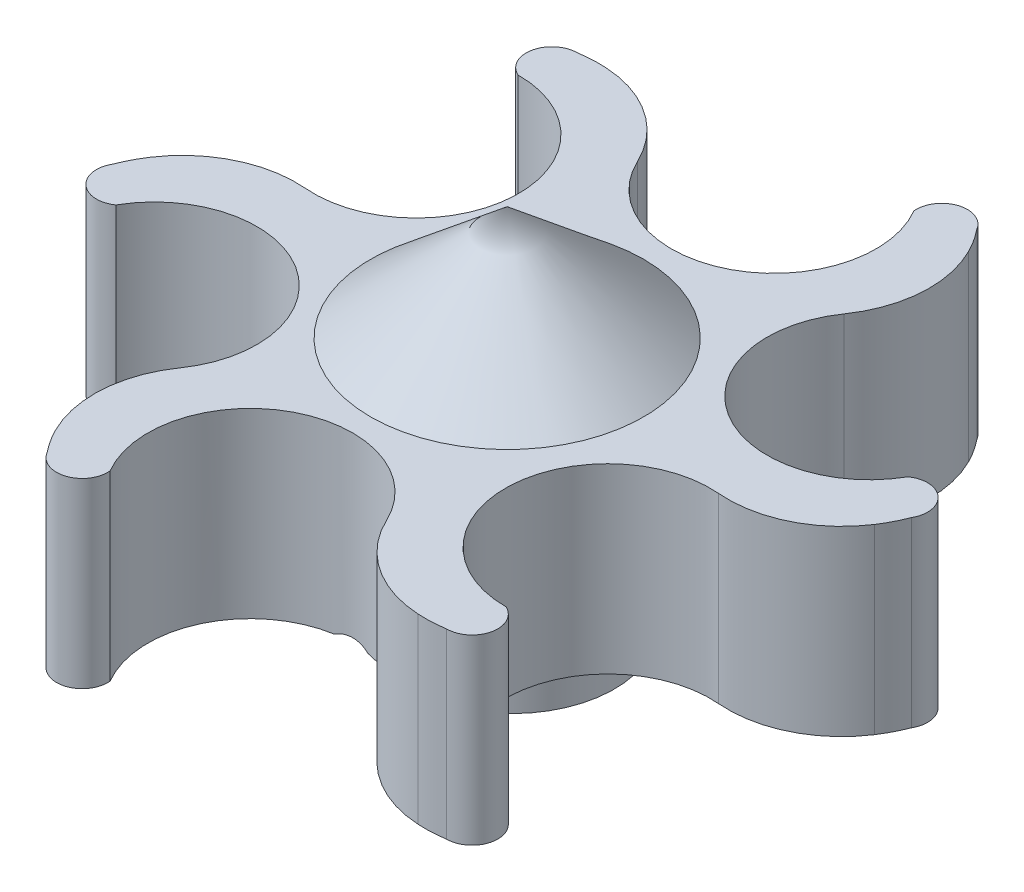
from build123d import *

# Parameters (mm, degrees)
BOSS_EXTRUDE1_DEPTH     = 16
BOSS_EXTRUDE2_START     = -16
BOSS_EXTRUDE2_DEPTH     = 16
FILLET1_R               = 10
SKETCH3_R               = 9
BOSS_EXTRUDE3_DEPTH     = 6
CUT_EXTRUDE1_DEPTH      = 47.217444076
CUT_EXTRUDE1_DEPTH_BACK = 47.217444076
SKETCH5_R               = 1.65
SKETCH10_R              = 2.85
CUT_EXTRUDE4_DEPTH      = 57.367261237


with BuildPart() as part:
    # Sketch1 → Boss-Extrude1 (new body)
    with BuildSketch(Plane(origin=(0, 0, 0), x_dir=(1, 0, 0), z_dir=(0, 1, 0))):
        with BuildLine():
            ThreePointArc((-22.806656603, 2.975972883), (-23, 0), (-22.806656603, -2.975972883))
            ThreePointArc((-22.806656603, -2.975972883), (-12.124355653, -7), (-13.980596419, -18.263157552))
            ThreePointArc((-13.980596419, -18.263157552), (-11.5, -19.918584287), (-8.826060184, -21.239130435))
            ThreePointArc((-8.826060184, -21.239130435), (0, -14), (8.826060184, -21.239130435))
            ThreePointArc((8.826060184, -21.239130435), (11.5, -19.918584287), (13.980596419, -18.263157552))
            ThreePointArc((13.980596419, -18.263157552), (12.124355653, -7), (22.806656603, -2.975972883))
            ThreePointArc((22.806656603, -2.975972883), (23, 0), (22.806656603, 2.975972883))
            ThreePointArc((22.806656603, 2.975972883), (12.124355653, 7), (13.980596419, 18.263157552))
            ThreePointArc((13.980596419, 18.263157552), (11.5, 19.918584287), (8.826060184, 21.239130435))
            ThreePointArc((8.826060184, 21.239130435), (0, 14), (-8.826060184, 21.239130435))
            ThreePointArc((-8.826060184, 21.239130435), (-11.5, 19.918584287), (-13.980596419, 18.263157552))
            ThreePointArc((-13.980596419, 18.263157552), (-12.124355653, 7), (-22.806656603, 2.975972883))
        make_face()
    extrude(amount=BOSS_EXTRUDE1_DEPTH)

    # Sketch2 → Boss-Extrude2 (add)
    with BuildSketch(Plane(origin=(0, 16, 0), x_dir=(1, 0, 0), z_dir=(0, 1, 0)).offset(BOSS_EXTRUDE2_START)):
        with BuildLine():
            ThreePointArc((-13.980596419, 18.263157552), (-16.774955839, 19.933125173), (-19.980596419, 20.499786358))
            ThreePointArc((-19.980596419, 20.499786358), (-21.238909345, 23.025125967), (-19.040914816, 24.794168535))
            ThreePointArc((-19.040914816, 24.794168535), (-13.4912909, 24.287233332), (-8.826060184, 21.239130435))
            ThreePointArc((-8.826060184, 21.239130435), (-11.5, 19.918584287), (-13.980596419, 18.263157552))
        make_face()
        with BuildLine():
            ThreePointArc((13.980596419, 18.263157552), (11.5, 19.918584287), (8.826060184, 21.239130435))
            ThreePointArc((8.826060184, 21.239130435), (8.875114857, 24.494100491), (7.763037549, 27.553597261))
            ThreePointArc((7.763037549, 27.553597261), (9.32088934, 29.905998025), (11.951922409, 28.88700021))
            ThreePointArc((11.951922409, 28.88700021), (14.287715603, 23.827417316), (13.980596419, 18.263157552))
        make_face()
        with BuildLine():
            ThreePointArc((22.806656603, -2.975972883), (23, 0), (22.806656603, 2.975972883))
            ThreePointArc((22.806656603, 2.975972883), (25.650070696, 4.560975318), (27.743633968, 7.053810902))
            ThreePointArc((27.743633968, 7.053810902), (30.559798685, 6.880872058), (30.992837225, 4.092831674))
            ThreePointArc((30.992837225, 4.092831674), (27.779006503, -0.459816017), (22.806656603, -2.975972883))
        make_face()
        with BuildLine():
            ThreePointArc((8.826060184, -21.239130435), (11.5, -19.918584287), (13.980596419, -18.263157552))
            ThreePointArc((13.980596419, -18.263157552), (16.774955839, -19.933125173), (19.980596419, -20.499786358))
            ThreePointArc((19.980596419, -20.499786358), (21.238909345, -23.025125967), (19.040914816, -24.794168535))
            ThreePointArc((19.040914816, -24.794168535), (13.4912909, -24.287233332), (8.826060184, -21.239130435))
        make_face()
        with BuildLine():
            ThreePointArc((-13.980596419, -18.263157552), (-11.5, -19.918584287), (-8.826060184, -21.239130435))
            ThreePointArc((-8.826060184, -21.239130435), (-8.875114857, -24.494100491), (-7.763037549, -27.553597261))
            ThreePointArc((-7.763037549, -27.553597261), (-9.32088934, -29.905998025), (-11.951922409, -28.88700021))
            ThreePointArc((-11.951922409, -28.88700021), (-14.287715603, -23.827417316), (-13.980596419, -18.263157552))
        make_face()
        with BuildLine():
            ThreePointArc((-22.806656603, 2.975972883), (-23, 0), (-22.806656603, -2.975972883))
            ThreePointArc((-22.806656603, -2.975972883), (-25.650070696, -4.560975318), (-27.743633968, -7.053810902))
            ThreePointArc((-27.743633968, -7.053810902), (-30.559798685, -6.880872058), (-30.992837225, -4.092831674))
            ThreePointArc((-30.992837225, -4.092831674), (-27.779006503, 0.459816017), (-22.806656603, 2.975972883))
        make_face()
    extrude(amount=BOSS_EXTRUDE2_DEPTH)

    # Fillet1
    fillet1_edges = [part.edges().sort_by_distance(p)[0] for p in [
        (13.980596419, 8, -18.263157552),
        (22.806656603, 8, 2.975972883),
        (8.826060184, 8, 21.239130435),
        (-13.980596419, 8, 18.263157552),
        (-22.806656603, 8, -2.975972883),
        (-8.826060184, 8, -21.239130435),
    ]]
    fillet(fillet1_edges, radius=FILLET1_R)

    # Sketch3 → Boss-Extrude3 (add)
    with BuildSketch(Plane.XZ):
        with Locations(Location((0, 0, 0), (0, 0, 90))):
            Circle(SKETCH3_R)
    extrude(amount=BOSS_EXTRUDE3_DEPTH)

    # Sketch5 → Cut-Extrude1 (cut, two sides: drawn at the far end of the back side and taken through both)
    with BuildSketch(Plane.XY.offset(-CUT_EXTRUDE1_DEPTH_BACK)):
        with Locations((0, -2.436)):
            Circle(SKETCH5_R)
    extrude(amount=CUT_EXTRUDE1_DEPTH + CUT_EXTRUDE1_DEPTH_BACK, mode=Mode.SUBTRACT)

    # Sketch6 → Revolve1 (revolve)
    with BuildSketch(Plane.XY, mode=Mode.PRIVATE) as revolve1_sk:
        Polygon((-0.426503876, 16), (-0.426503876, 26), (11.573496124, 16), align=None)
    revolve(revolve1_sk.sketch.rotate(Axis((-0.426503876, 16, 0), (0, 1, 0)), 90), axis=Axis((-0.426503876, 16, 0), (0, 1, 0)))

    # Sketch10 → Cut-Extrude4 (cut, through all)
    with BuildSketch(Plane.XY.offset(9)):
        with Locations((0, -2.436)):
            Circle(SKETCH10_R)
    cut_extrude4 = extrude(amount=CUT_EXTRUDE4_DEPTH, mode=Mode.SUBTRACT)

    # Mirror1: Cut-Extrude4 across plane
    add(cut_extrude4.mirror(Plane.XY), mode=Mode.SUBTRACT)


solid = part.part
